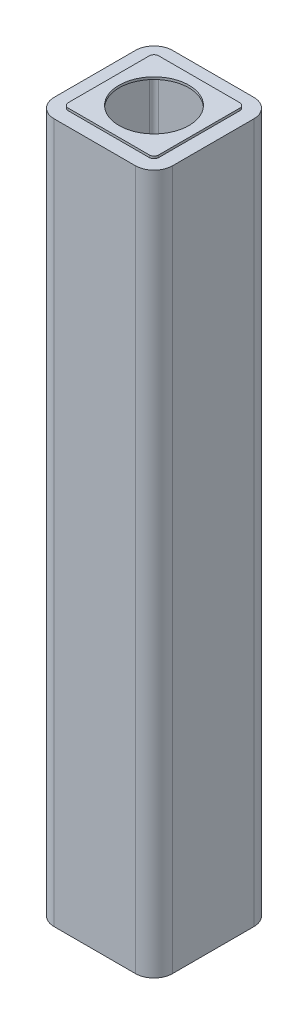
from build123d import *

# Parameters (mm, degrees)
SQUARE_TUBE_20_X_20_X_2_1_DEPTH = 150
SKETCH13_R                      = 7.5
BOSS_EXTRUDE1_DEPTH             = 0.5


with BuildPart() as part:
    # Sketch12 → Square tube 20 X 20 X 2(1) (new body)
    with BuildSketch(Plane(origin=(0, 0, 0), x_dir=(1, 0, 0), z_dir=(0, 1, 0))):
        with BuildLine():
            Line((-8.7, -12.7), (8.7, -12.7))
            ThreePointArc((8.7, -12.7), (11.528427125, -11.528427125), (12.7, -8.7))
            Line((12.7, -8.7), (12.7, 8.7))
            ThreePointArc((12.7, 8.7), (11.528427125, 11.528427125), (8.7, 12.7))
            Line((8.7, 12.7), (-8.7, 12.7))
            ThreePointArc((-8.7, 12.7), (-11.528427125, 11.528427125), (-12.7, 8.7))
            Line((-12.7, 8.7), (-12.7, -8.7))
            ThreePointArc((-12.7, -8.7), (-11.528427125, -11.528427125), (-8.7, -12.7))
        make_face()
        with BuildLine():
            Line((-8.7, -9.7), (8.7, -9.7))
            ThreePointArc((8.7, -9.7), (9.407106781, -9.407106781), (9.7, -8.7))
            Line((9.7, -8.7), (9.7, 8.7))
            ThreePointArc((9.7, 8.7), (9.407106781, 9.407106781), (8.7, 9.7))
            Line((8.7, 9.7), (-8.7, 9.7))
            ThreePointArc((-8.7, 9.7), (-9.407106781, 9.407106781), (-9.7, 8.7))
            Line((-9.7, 8.7), (-9.7, -8.7))
            ThreePointArc((-9.7, -8.7), (-9.407106781, -9.407106781), (-8.7, -9.7))
        make_face(mode=Mode.SUBTRACT)
    extrude(amount=SQUARE_TUBE_20_X_20_X_2_1_DEPTH)


with BuildPart() as body_2:
    # Sketch13 → Boss-Extrude1 (new body)
    with BuildSketch(Plane(origin=(0, 150, 0), x_dir=(1, 0, 0), z_dir=(0, 1, 0))):
        with BuildLine():
            Line((9.7, -8.7), (9.7, 8.7))
            ThreePointArc((9.7, 8.7), (9.407106781, 9.407106781), (8.7, 9.7))
            Line((8.7, 9.7), (-8.7, 9.7))
            ThreePointArc((-8.7, 9.7), (-9.407106781, 9.407106781), (-9.7, 8.7))
            Line((-9.7, 8.7), (-9.7, -8.7))
            ThreePointArc((-9.7, -8.7), (-9.407106781, -9.407106781), (-8.7, -9.7))
            Line((-8.7, -9.7), (8.7, -9.7))
            ThreePointArc((8.7, -9.7), (9.407106781, -9.407106781), (9.7, -8.7))
        make_face()
        with Locations(Location((0, 0, 0), (0, 0, 270))):
            Circle(SKETCH13_R, mode=Mode.SUBTRACT)
    extrude(amount=BOSS_EXTRUDE1_DEPTH)


solid = Compound([part.part, body_2.part])
